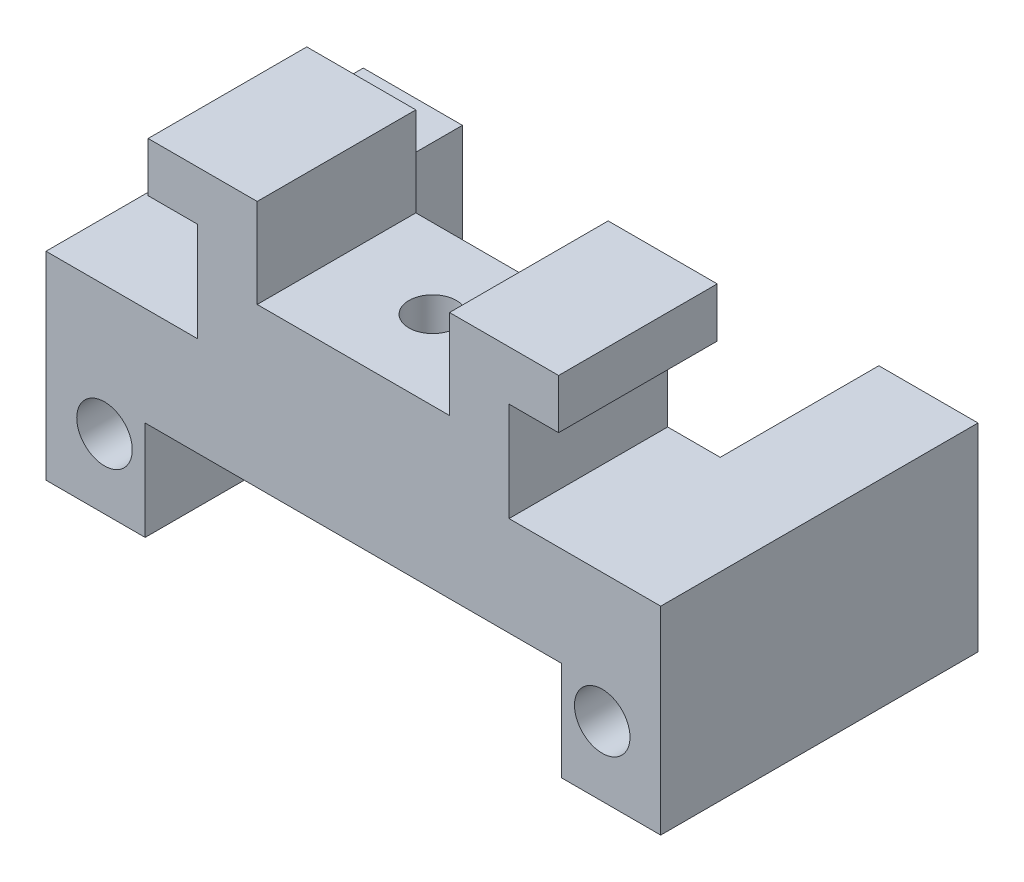
from build123d import *

# Parameters (mm, degrees)
ESQUISSE1_R             = 1.4
BOSS_EXTRU_1_DEPTH      = 16
ESQUISSE2_W             = 15.7
ESQUISSE2_H             = 16
BOSS_EXTRU_2_DEPTH      = 15
ESQUISSE3_R             = 4
ENL_V_MAT_EXTRU_1_DEPTH = 15
ESQUISSE4_W             = 21
ESQUISSE4_H             = 8
ENL_V_MAT_EXTRU_2_DEPTH = 21
ESQUISSE5_R             = 1.4
ENL_V_MAT_EXTRU_3_DEPTH = 21
ESQUISSE6_W             = 18.213974707
ESQUISSE6_H             = 12
ENL_V_MAT_EXTRU_4_DEPTH = 10
ESQUISSE7_R             = 1.2
ENL_V_MAT_EXTRU_5_DEPTH = 24.669600757
BOSS_EXTRU_3_DEPTH      = 8


with BuildPart() as part:
    # Esquisse1 → Boss.-Extru.1 (new body)
    with BuildSketch(Plane.XY):
        Polygon((15.5, 10), (-15.5, 10), (-15.5, 0), (-10.5, 0), (-10.5, 5), (10.5, 5), (10.5, 0), (15.5, 0), align=None)
        with Locations((12.55, 3.5)):
            Circle(ESQUISSE1_R, mode=Mode.SUBTRACT)
        with Locations(Location((-12.55, 3.5, 0), (0, 0, 180))):
            Circle(ESQUISSE1_R, mode=Mode.SUBTRACT)
    extrude(amount=BOSS_EXTRU_1_DEPTH)

    # Esquisse2 → Boss.-Extru.2 (add)
    with BuildSketch(Plane(origin=(0, 10, 0), x_dir=(1, 0, 0), z_dir=(0, 1, 0))):
        with Locations((0, -8)):
            Rectangle(ESQUISSE2_W, ESQUISSE2_H)
    extrude(amount=BOSS_EXTRU_2_DEPTH)

    # Esquisse3 → Enlèv. mat.-Extru.1 (cut)
    with BuildSketch(Plane.XY.offset(16)):
        with Locations((0, 17.5)):
            Circle(ESQUISSE3_R)
    extrude(amount=-ENL_V_MAT_EXTRU_1_DEPTH, mode=Mode.SUBTRACT)

    # Esquisse4 → Enlèv. mat.-Extru.2 (cut)
    with BuildSketch(Plane.XZ.offset(-5)):
        with Locations((0, 4)):
            Rectangle(ESQUISSE4_W, ESQUISSE4_H)
    extrude(amount=-ENL_V_MAT_EXTRU_2_DEPTH, mode=Mode.SUBTRACT)

    # Esquisse5 → Enlèv. mat.-Extru.3 (cut)
    with BuildSketch(Plane.ZY.offset(7.85)):
        with Locations((12, 17.5)):
            Circle(ESQUISSE5_R)
    extrude(amount=-ENL_V_MAT_EXTRU_3_DEPTH, mode=Mode.SUBTRACT)

    # Esquisse6 → Enlèv. mat.-Extru.4 (cut)
    with BuildSketch(Plane.XY.offset(16)):
        with Locations((-1.256987354, 19)):
            Rectangle(ESQUISSE6_W, ESQUISSE6_H)
    extrude(amount=-ENL_V_MAT_EXTRU_4_DEPTH, mode=Mode.SUBTRACT)

    # Esquisse7 → Enlèv. mat.-Extru.5 (cut, through all)
    with BuildSketch(Plane.XZ.offset(-5)):
        with Locations(Location((0, 12, 0), (0, 0, 270))):
            Circle(ESQUISSE7_R)
    extrude(amount=-ENL_V_MAT_EXTRU_5_DEPTH, mode=Mode.SUBTRACT)

    # Esquisse8 → Boss.-Extru.3 (add)
    with BuildSketch(Plane.XY.offset(16)):
        Polygon((-7.85, 13), (-7.85, 15), (-10.35, 15), (-10.35, 17.5), (-4.85, 17.5), (-4.85, 13), align=None)
        Polygon((4.85, 13), (7.85, 13), (7.85, 15), (10.35, 15), (10.35, 17.5), (4.85, 17.5), align=None)
    extrude(amount=-BOSS_EXTRU_3_DEPTH)


solid = part.part
